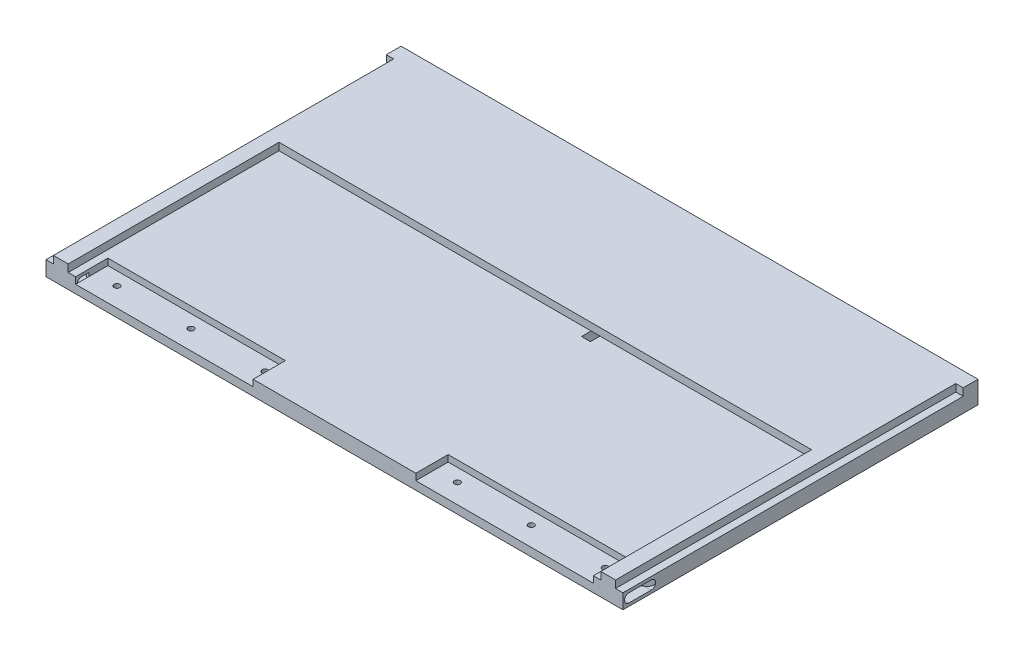
from build123d import *

# Parameters (mm, degrees)
SKETCH1_W           = 482.6
SKETCH1_H           = 304.8
SKETCH1_R           = 2.5019
BOSS_EXTRUDE1_DEPTH = 12.7
BOSS_EXTRUDE2_DEPTH = 6.35
SKETCH4_W           = 6.35
SKETCH4_H           = 12.7
BOSS_EXTRUDE3_DEPTH = 292.1
SKETCH5_W           = 12.7
SKETCH5_H           = 19.05
BOSS_EXTRUDE4_DEPTH = 6.35
CUT_EXTRUDE2_START  = 6.35
CUT_EXTRUDE2_DEPTH  = 25.4
CUT_EXTRUDE3_START  = -463.55
CUT_EXTRUDE3_DEPTH  = 25.4
BOSS_EXTRUDE5_START = -2.54
BOSS_EXTRUDE5_DEPTH = 7.62
SKETCH13_W          = 152.4
SKETCH13_H          = 27.7368
CUT_EXTRUDE4_DEPTH  = 5.588
SKETCH14_W          = 7.62
SKETCH14_H          = 19.05
CUT_EXTRUDE5_DEPTH  = 12.7


with BuildPart() as part:
    # Sketch1 → Boss-Extrude1 (new body)
    with BuildSketch(Plane(origin=(0, 0, 0), x_dir=(1, 0, 0), z_dir=(0, 1, 0))):
        Rectangle(SKETCH1_W, SKETCH1_H)
        with Locations(Location((-203.2, -135.8392, 0), (0, 0, 270))):
            Circle(SKETCH1_R, mode=Mode.SUBTRACT)
        with Locations(Location((-139.7, -135.8392, 0), (0, 0, 270))):
            Circle(SKETCH1_R, mode=Mode.SUBTRACT)
        with Locations(Location((-76.2, -135.8392, 0), (0, 0, 270))):
            Circle(SKETCH1_R, mode=Mode.SUBTRACT)
        with Locations(Location((88.9, -135.8392, 0), (0, 0, 270))):
            Circle(SKETCH1_R, mode=Mode.SUBTRACT)
        with Locations(Location((152.4, -135.8392, 0), (0, 0, 270))):
            Circle(SKETCH1_R, mode=Mode.SUBTRACT)
        with Locations(Location((215.9, -135.8392, 0), (0, 0, 270))):
            Circle(SKETCH1_R, mode=Mode.SUBTRACT)
    extrude(amount=BOSS_EXTRUDE1_DEPTH)

    # Sketch2 → Boss-Extrude2 (add)
    with BuildSketch(Plane(origin=(0, 12.7, 0), x_dir=(1, 0, 0), z_dir=(0, 1, 0))):
        Polygon((-241.3, 152.4), (-228.6, 152.4), (228.6, 152.4), (241.3, 152.4), (241.3, -152.4), (228.6, -152.4), (228.6, 28.575), (-228.6, 28.575), (-228.6, -152.4), (-241.3, -152.4), align=None)
    extrude(amount=BOSS_EXTRUDE2_DEPTH)

    # Sketch4 → Boss-Extrude3 (add)
    with BuildSketch(Plane.XY.offset(152.4)):
        with Locations((-244.475, 6.35)):
            Rectangle(SKETCH4_W, SKETCH4_H)
    boss_extrude3 = extrude(amount=-BOSS_EXTRUDE3_DEPTH)

    # Sketch5 → Boss-Extrude4 (add)
    with BuildSketch(Plane.ZY.offset(241.3)):
        with Locations((-146.05, 9.525)):
            Rectangle(SKETCH5_W, SKETCH5_H)
    boss_extrude4 = extrude(amount=BOSS_EXTRUDE4_DEPTH)

    # Mirror1: Boss-Extrude3, Boss-Extrude4 across plane
    add(boss_extrude3.mirror(Plane(origin=(0, 0, 0), x_dir=(0, 0, 1), z_dir=(1, 0, 0))))
    add(boss_extrude4.mirror(Plane(origin=(0, 0, 0), x_dir=(0, 0, 1), z_dir=(1, 0, 0))))

    # Sketch6 → Cut-Extrude2 (cut)
    with BuildSketch(Plane.ZY.offset(241.3).offset(CUT_EXTRUDE2_START)):
        with BuildLine():
            Line((147.32, 2.54), (128.27, 2.54))
            ThreePointArc((128.27, 2.54), (124.46, 6.35), (128.27, 10.16))
            Line((128.27, 10.16), (147.32, 10.16))
            ThreePointArc((147.32, 10.16), (151.13, 6.35), (147.32, 2.54))
        make_face()
    extrude(amount=-CUT_EXTRUDE2_DEPTH, mode=Mode.SUBTRACT)

    # Sketch6<2> → Cut-Extrude3 (cut)
    with BuildSketch(Plane.ZY.offset(241.3).offset(CUT_EXTRUDE3_START)):
        with BuildLine():
            Line((147.32, 2.54), (128.27, 2.54))
            ThreePointArc((128.27, 2.54), (124.46, 6.35), (128.27, 10.16))
            Line((128.27, 10.16), (147.32, 10.16))
            ThreePointArc((147.32, 10.16), (151.13, 6.35), (147.32, 2.54))
        make_face()
    extrude(amount=-CUT_EXTRUDE3_DEPTH, mode=Mode.SUBTRACT)

    # Sketch11 → Boss-Extrude5 (add)
    with BuildSketch(Plane.XZ.offset(BOSS_EXTRUDE5_START)):
        Polygon((-247.65, 124.46), (-222.25, 124.46), (-222.25, 140.97), align=None)
    boss_extrude5 = extrude(amount=-BOSS_EXTRUDE5_DEPTH)

    # Mirror2: Boss-Extrude5 across plane
    add(boss_extrude5.mirror(Plane(origin=(0, 0, 0), x_dir=(0, 0, 1), z_dir=(1, 0, 0))))

    # Sketch13 → Cut-Extrude4 (cut)
    with BuildSketch(Plane(origin=(0, 12.7, 0), x_dir=(1, 0, 0), z_dir=(0, 1, 0))):
        with Locations((146.05, -138.5316)):
            Rectangle(SKETCH13_W, SKETCH13_H)
        with Locations((-146.05, -138.5316)):
            Rectangle(SKETCH13_W, SKETCH13_H)
    extrude(amount=-CUT_EXTRUDE4_DEPTH, mode=Mode.SUBTRACT)

    # Sketch14 → Cut-Extrude5 (cut)
    with BuildSketch(Plane.XZ):
        with Locations((43.18, -29.845)):
            Rectangle(SKETCH14_W, SKETCH14_H)
    extrude(amount=-CUT_EXTRUDE5_DEPTH, mode=Mode.SUBTRACT)


solid = part.part
